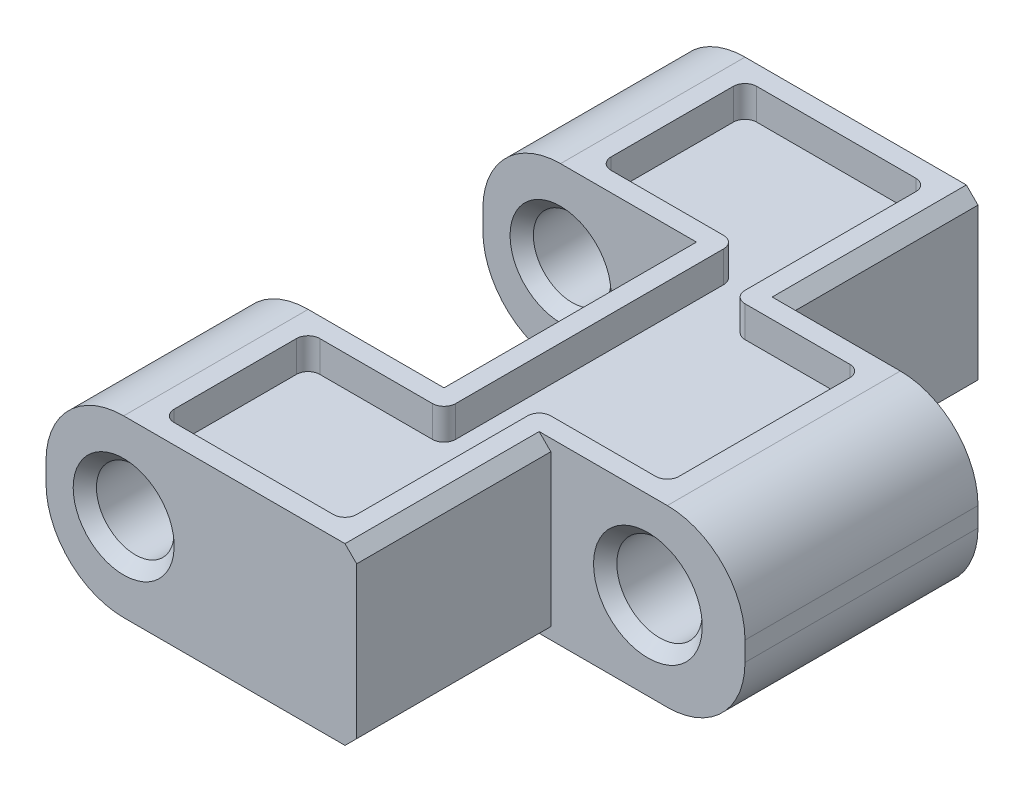
from build123d import *

# Parameters (mm, degrees)
GRUNDK_RPER_DEPTH         = 4.5
ACHSBOHHRUNGEN_DEPTH      = 16.913830463
ACHSBOHHRUNGEN_DEPTH_BACK = 16.913830463
SKIZZE2_R                 = 1
SKIZZE2_R_2               = 1.1
SKIZZE3_W                 = 2
SKIZZE3_H                 = 6.5
AUSSCHNITT_ZAHN_DEPTH     = 3
VERRUNDUNG2_R             = 2
FASE1_SIZE                = 0.3
FASE2_SIZE                = 0.3
MOOSGUMMIVERTIEFUNG_DEPTH = 0.8
VERRUNDUNG8_R             = 0.3


with BuildPart() as part:
    # Skizze1 → Grundkörper (new body)
    with BuildSketch(Plane(origin=(0, 0, 0), x_dir=(1, 0, 0), z_dir=(0, 1, 0))):
        Polygon((5.5, 3.25), (5.5, -3.25), (0, -3.25), (0, -8), (8, -8), (8, -3), (13, -3), (13, 3), (8, 3), (8, 8), (0, 8), (0, 3.25), align=None)
    extrude(amount=GRUNDK_RPER_DEPTH)

    # Skizze2 → Achsbohhrungen (cut, two sides: drawn at the far end of the back side and taken through both)
    with BuildSketch(Plane.XY.offset(-ACHSBOHHRUNGEN_DEPTH_BACK)):
        with Locations((2, 2.25)):
            Circle(SKIZZE2_R)
        with Locations((10.5, 2.25)):
            Circle(SKIZZE2_R_2)
    extrude(amount=ACHSBOHHRUNGEN_DEPTH + ACHSBOHHRUNGEN_DEPTH_BACK, mode=Mode.SUBTRACT)

    # Skizze3 → Ausschnitt Zahn (cut)
    with BuildSketch(Plane.XZ):
        with Locations((6.5, 0)):
            Rectangle(SKIZZE3_W, SKIZZE3_H)
    extrude(amount=-AUSSCHNITT_ZAHN_DEPTH, mode=Mode.SUBTRACT)

    # Verrundung2
    verrundung2_edges = [part.edges().sort_by_distance(p)[0] for p in [
        (0, 0, -5.625),
        (13, 0, 0),
        (0, 0, 5.625),
        (13, 4.5, 0),
        (0, 4.5, -5.625),
        (0, 4.5, 5.625),
    ]]
    fillet(verrundung2_edges, radius=VERRUNDUNG2_R)

    # Fase1
    fase1_edges = [part.edges().sort_by_distance(p)[0] for p in [
        (8, 0, -5.5),
        (8, 4.5, 5.5),
        (8, 0, 5.5),
        (8, 4.5, -5.5),
    ]]
    chamfer(fase1_edges, length=FASE1_SIZE)

    # Fase2
    fase2_edges = [part.edges().sort_by_distance(p)[0] for p in [
        (1, 2.25, 3.25),
        (1, 2.25, -8),
        (1, 2.25, -3.25),
        (1, 2.25, 8),
        (9.4, 2.25, -3),
        (9.4, 2.25, 3),
    ]]
    chamfer(fase2_edges, length=FASE2_SIZE)

    # Skizze6 → MoosgummiVertiefung (cut)
    with BuildSketch(Plane(origin=(0, 4.5, 0), x_dir=(1, 0, 0), z_dir=(0, 1, 0))):
        Polygon((10.5, -2.5), (10.5, 2.5), (7.2, 2.5), (7.2, 7.5), (2.5, 7.5), (2.5, 3.75), (6, 3.75), (6, -3.75), (2.5, -3.75), (2.5, -7.5), (7.2, -7.5), (7.2, -2.5), align=None)
    extrude(amount=-MOOSGUMMIVERTIEFUNG_DEPTH, mode=Mode.SUBTRACT)

    # Verrundung8
    verrundung8_edges = [part.edges().sort_by_distance(p)[0] for p in [
        (10.5, 4.1, 2.5),
        (7.2, 4.1, 2.5),
        (7.2, 4.1, 7.5),
        (2.5, 4.1, 7.5),
        (2.5, 4.1, 3.75),
        (6, 4.1, 3.75),
        (6, 4.1, -3.75),
        (2.5, 4.1, -3.75),
        (2.5, 4.1, -7.5),
        (7.2, 4.1, -7.5),
        (7.2, 4.1, -2.5),
        (10.5, 4.1, -2.5),
    ]]
    fillet(verrundung8_edges, radius=VERRUNDUNG8_R)


solid = part.part
